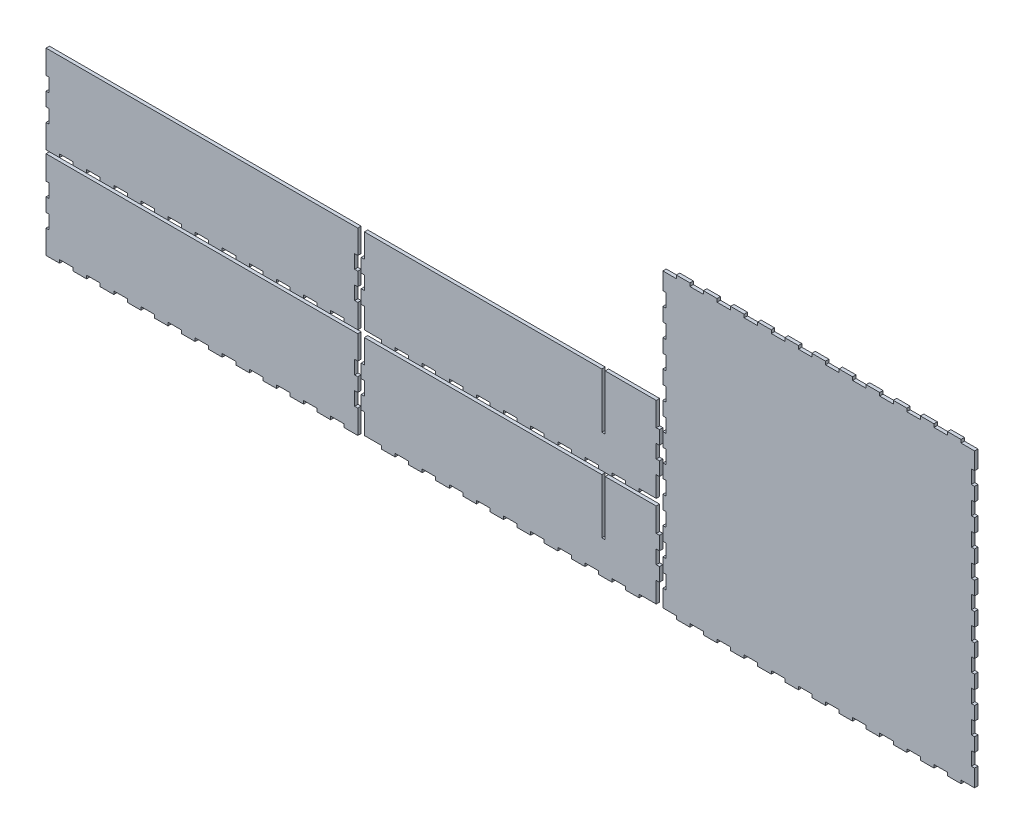
from build123d import *

# Parameters (mm, degrees)
BOSS_EXTRUDE1_DEPTH   = 3.175
BOSS_EXTRUDE1_2_DEPTH = 3.175
BOSS_EXTRUDE1_3_DEPTH = 3.175
BOSS_EXTRUDE1_4_DEPTH = 3.175
BOSS_EXTRUDE1_5_DEPTH = 3.175
SKETCH2_W             = 3.175
SKETCH2_H             = 51.308
CUT_EXTRUDE1_DEPTH    = 3.175


with BuildPart() as part:
    # Model → Boss-Extrude1 (new body)
    with BuildSketch(Plane.XY):
        Polygon((0, 85.725), (0, 63.5), (2.9972, 63.5), (2.9972, 50.8), (0, 50.8), (0, 38.1), (2.9972, 38.1), (2.9972, 25.4), (0, 25.4), (0, 3.175), (12.7, 3.175), (12.7, 6.1722), (25.4, 6.1722), (25.4, 3.175), (38.1, 3.175), (38.1, 6.1722), (50.8, 6.1722), (50.8, 3.175), (63.5, 3.175), (63.5, 6.1722), (76.2, 6.1722), (76.2, 3.175), (88.9, 3.175), (88.9, 6.1722), (101.6, 6.1722), (101.6, 3.175), (114.3, 3.175), (114.3, 6.1722), (127, 6.1722), (127, 3.175), (139.7, 3.175), (139.7, 6.1722), (152.4, 6.1722), (152.4, 3.175), (165.1, 3.175), (165.1, 6.1722), (177.8, 6.1722), (177.8, 3.175), (190.5, 3.175), (190.5, 6.1722), (203.2, 6.1722), (203.2, 3.175), (215.9, 3.175), (215.9, 6.1722), (228.6, 6.1722), (228.6, 3.175), (241.3, 3.175), (241.3, 6.1722), (254, 6.1722), (254, 3.175), (266.7, 3.175), (266.7, 6.1722), (279.4, 6.1722), (279.4, 3.175), (292.1, 3.175), (292.1, 25.4), (289.1028, 25.4), (289.1028, 38.1), (292.1, 38.1), (292.1, 50.8), (289.1028, 50.8), (289.1028, 63.5), (292.1, 63.5), (292.1, 85.725), align=None)
    extrude(amount=BOSS_EXTRUDE1_DEPTH)


with BuildPart() as body_2:
    # Model → Boss-Extrude1 2 (new body)
    with BuildSketch(Plane.XY):
        Polygon((298.2722, 85.725), (298.2722, 63.5), (295.275, 63.5), (295.275, 50.8), (298.2722, 50.8), (298.2722, 38.1), (295.275, 38.1), (295.275, 25.4), (298.2722, 25.4), (298.2722, 6.1722), (314.325, 6.1722), (314.325, 3.175), (327.025, 3.175), (327.025, 6.1722), (339.725, 6.1722), (339.725, 3.175), (352.425, 3.175), (352.425, 6.1722), (365.125, 6.1722), (365.125, 3.175), (377.825, 3.175), (377.825, 6.1722), (390.525, 6.1722), (390.525, 3.175), (403.225, 3.175), (403.225, 6.1722), (415.925, 6.1722), (415.925, 3.175), (428.625, 3.175), (428.625, 6.1722), (441.325, 6.1722), (441.325, 3.175), (454.025, 3.175), (454.025, 6.1722), (466.725, 6.1722), (466.725, 3.175), (479.425, 3.175), (479.425, 6.1722), (492.125, 6.1722), (492.125, 3.175), (504.825, 3.175), (504.825, 6.1722), (517.525, 6.1722), (517.525, 3.175), (530.225, 3.175), (530.225, 6.1722), (542.925, 6.1722), (542.925, 3.175), (555.625, 3.175), (555.625, 6.1722), (571.6778, 6.1722), (571.6778, 25.4), (574.675, 25.4), (574.675, 38.1), (571.6778, 38.1), (571.6778, 50.8), (574.675, 50.8), (574.675, 63.5), (571.6778, 63.5), (571.6778, 85.725), align=None)
    extrude(amount=BOSS_EXTRUDE1_2_DEPTH)


with BuildPart() as body_3:
    # Model → Boss-Extrude1 3 (new body)
    with BuildSketch(Plane.XY):
        Polygon((857.25, 3.175), (857.25, 6.1722), (869.95, 6.1722), (869.95, 22.225), (866.9528, 22.225), (866.9528, 34.925), (869.95, 34.925), (869.95, 47.625), (866.9528, 47.625), (866.9528, 60.325), (869.95, 60.325), (869.95, 73.025), (866.9528, 73.025), (866.9528, 85.725), (869.95, 85.725), (869.95, 98.425), (866.9528, 98.425), (866.9528, 111.125), (869.95, 111.125), (869.95, 123.825), (866.9528, 123.825), (866.9528, 136.525), (869.95, 136.525), (869.95, 149.225), (866.9528, 149.225), (866.9528, 161.925), (869.95, 161.925), (869.95, 174.625), (866.9528, 174.625), (866.9528, 187.325), (869.95, 187.325), (869.95, 200.025), (866.9528, 200.025), (866.9528, 212.725), (869.95, 212.725), (869.95, 225.425), (866.9528, 225.425), (866.9528, 238.125), (869.95, 238.125), (869.95, 250.825), (866.9528, 250.825), (866.9528, 263.525), (869.95, 263.525), (869.95, 279.5778), (857.25, 279.5778), (857.25, 282.575), (844.55, 282.575), (844.55, 279.5778), (831.85, 279.5778), (831.85, 282.575), (819.15, 282.575), (819.15, 279.5778), (806.45, 279.5778), (806.45, 282.575), (793.75, 282.575), (793.75, 279.5778), (781.05, 279.5778), (781.05, 282.575), (768.35, 282.575), (768.35, 279.5778), (755.65, 279.5778), (755.65, 282.575), (742.95, 282.575), (742.95, 279.5778), (730.25, 279.5778), (730.25, 282.575), (717.55, 282.575), (717.55, 279.5778), (704.85, 279.5778), (704.85, 282.575), (692.15, 282.575), (692.15, 279.5778), (679.45, 279.5778), (679.45, 282.575), (666.75, 282.575), (666.75, 279.5778), (654.05, 279.5778), (654.05, 282.575), (641.35, 282.575), (641.35, 279.5778), (628.65, 279.5778), (628.65, 282.575), (615.95, 282.575), (615.95, 279.5778), (603.25, 279.5778), (603.25, 282.575), (590.55, 282.575), (590.55, 279.5778), (577.85, 279.5778), (577.85, 263.525), (580.8472, 263.525), (580.8472, 250.825), (577.85, 250.825), (577.85, 238.125), (580.8472, 238.125), (580.8472, 225.425), (577.85, 225.425), (577.85, 212.725), (580.8472, 212.725), (580.8472, 200.025), (577.85, 200.025), (577.85, 187.325), (580.8472, 187.325), (580.8472, 174.625), (577.85, 174.625), (577.85, 161.925), (580.8472, 161.925), (580.8472, 149.225), (577.85, 149.225), (577.85, 136.525), (580.8472, 136.525), (580.8472, 123.825), (577.85, 123.825), (577.85, 111.125), (580.8472, 111.125), (580.8472, 98.425), (577.85, 98.425), (577.85, 85.725), (580.8472, 85.725), (580.8472, 73.025), (577.85, 73.025), (577.85, 60.325), (580.8472, 60.325), (580.8472, 47.625), (577.85, 47.625), (577.85, 34.925), (580.8472, 34.925), (580.8472, 22.225), (577.85, 22.225), (577.85, 6.1722), (590.55, 6.1722), (590.55, 3.175), (603.25, 3.175), (603.25, 6.1722), (615.95, 6.1722), (615.95, 3.175), (628.65, 3.175), (628.65, 6.1722), (641.35, 6.1722), (641.35, 3.175), (654.05, 3.175), (654.05, 6.1722), (666.75, 6.1722), (666.75, 3.175), (679.45, 3.175), (679.45, 6.1722), (692.15, 6.1722), (692.15, 3.175), (704.85, 3.175), (704.85, 6.1722), (717.55, 6.1722), (717.55, 3.175), (730.25, 3.175), (730.25, 6.1722), (742.95, 6.1722), (742.95, 3.175), (755.65, 3.175), (755.65, 6.1722), (768.35, 6.1722), (768.35, 3.175), (781.05, 3.175), (781.05, 6.1722), (793.75, 6.1722), (793.75, 3.175), (806.45, 3.175), (806.45, 6.1722), (819.15, 6.1722), (819.15, 3.175), (831.85, 3.175), (831.85, 6.1722), (844.55, 6.1722), (844.55, 3.175), align=None)
    extrude(amount=BOSS_EXTRUDE1_3_DEPTH)


with BuildPart() as body_4:
    # Model → Boss-Extrude1 4 (new body)
    with BuildSketch(Plane.XY):
        Polygon((0, 171.45), (0, 149.225), (2.9972, 149.225), (2.9972, 136.525), (0, 136.525), (0, 123.825), (2.9972, 123.825), (2.9972, 111.125), (0, 111.125), (0, 88.9), (12.7, 88.9), (12.7, 91.8972), (25.4, 91.8972), (25.4, 88.9), (38.1, 88.9), (38.1, 91.8972), (50.8, 91.8972), (50.8, 88.9), (63.5, 88.9), (63.5, 91.8972), (76.2, 91.8972), (76.2, 88.9), (88.9, 88.9), (88.9, 91.8972), (101.6, 91.8972), (101.6, 88.9), (114.3, 88.9), (114.3, 91.8972), (127, 91.8972), (127, 88.9), (139.7, 88.9), (139.7, 91.8972), (152.4, 91.8972), (152.4, 88.9), (165.1, 88.9), (165.1, 91.8972), (177.8, 91.8972), (177.8, 88.9), (190.5, 88.9), (190.5, 91.8972), (203.2, 91.8972), (203.2, 88.9), (215.9, 88.9), (215.9, 91.8972), (228.6, 91.8972), (228.6, 88.9), (241.3, 88.9), (241.3, 91.8972), (254, 91.8972), (254, 88.9), (266.7, 88.9), (266.7, 91.8972), (279.4, 91.8972), (279.4, 88.9), (292.1, 88.9), (292.1, 111.125), (289.1028, 111.125), (289.1028, 123.825), (292.1, 123.825), (292.1, 136.525), (289.1028, 136.525), (289.1028, 149.225), (292.1, 149.225), (292.1, 171.45), align=None)
    extrude(amount=BOSS_EXTRUDE1_4_DEPTH)


with BuildPart() as body_5:
    # Model → Boss-Extrude1 5 (new body)
    with BuildSketch(Plane.XY):
        Polygon((298.2722, 171.45), (298.2722, 149.225), (295.275, 149.225), (295.275, 136.525), (298.2722, 136.525), (298.2722, 123.825), (295.275, 123.825), (295.275, 111.125), (298.2722, 111.125), (298.2722, 91.8972), (314.325, 91.8972), (314.325, 88.9), (327.025, 88.9), (327.025, 91.8972), (339.725, 91.8972), (339.725, 88.9), (352.425, 88.9), (352.425, 91.8972), (365.125, 91.8972), (365.125, 88.9), (377.825, 88.9), (377.825, 91.8972), (390.525, 91.8972), (390.525, 88.9), (403.225, 88.9), (403.225, 91.8972), (415.925, 91.8972), (415.925, 88.9), (428.625, 88.9), (428.625, 91.8972), (441.325, 91.8972), (441.325, 88.9), (454.025, 88.9), (454.025, 91.8972), (466.725, 91.8972), (466.725, 88.9), (479.425, 88.9), (479.425, 91.8972), (492.125, 91.8972), (492.125, 88.9), (504.825, 88.9), (504.825, 91.8972), (517.525, 91.8972), (517.525, 88.9), (530.225, 88.9), (530.225, 91.8972), (542.925, 91.8972), (542.925, 88.9), (555.625, 88.9), (555.625, 91.8972), (571.6778, 91.8972), (571.6778, 111.125), (574.675, 111.125), (574.675, 123.825), (571.6778, 123.825), (571.6778, 136.525), (574.675, 136.525), (574.675, 149.225), (571.6778, 149.225), (571.6778, 171.45), align=None)
    extrude(amount=BOSS_EXTRUDE1_5_DEPTH)


with BuildPart() as cut_extrude1_tool:
    # Sketch2 → Cut-Extrude1 (new body)
    with BuildSketch(Plane.XY.offset(3.175)):
        with Locations((522.2875, 145.796)):
            Rectangle(SKETCH2_W, SKETCH2_H)
        with Locations((522.2875, 60.071)):
            Rectangle(SKETCH2_W, SKETCH2_H)
    extrude(amount=-CUT_EXTRUDE1_DEPTH)


with BuildPart() as body_2_1:
    add(body_2.part)

    # Cut-Extrude1: cut by cut_extrude1_tool
    add(cut_extrude1_tool.part, mode=Mode.SUBTRACT)


with BuildPart() as body_5_1:
    add(body_5.part)

    # Cut-Extrude1: cut by cut_extrude1_tool
    add(cut_extrude1_tool.part, mode=Mode.SUBTRACT)


solid = Compound([part.part, body_3.part, body_4.part, body_2_1.part, body_5_1.part])
